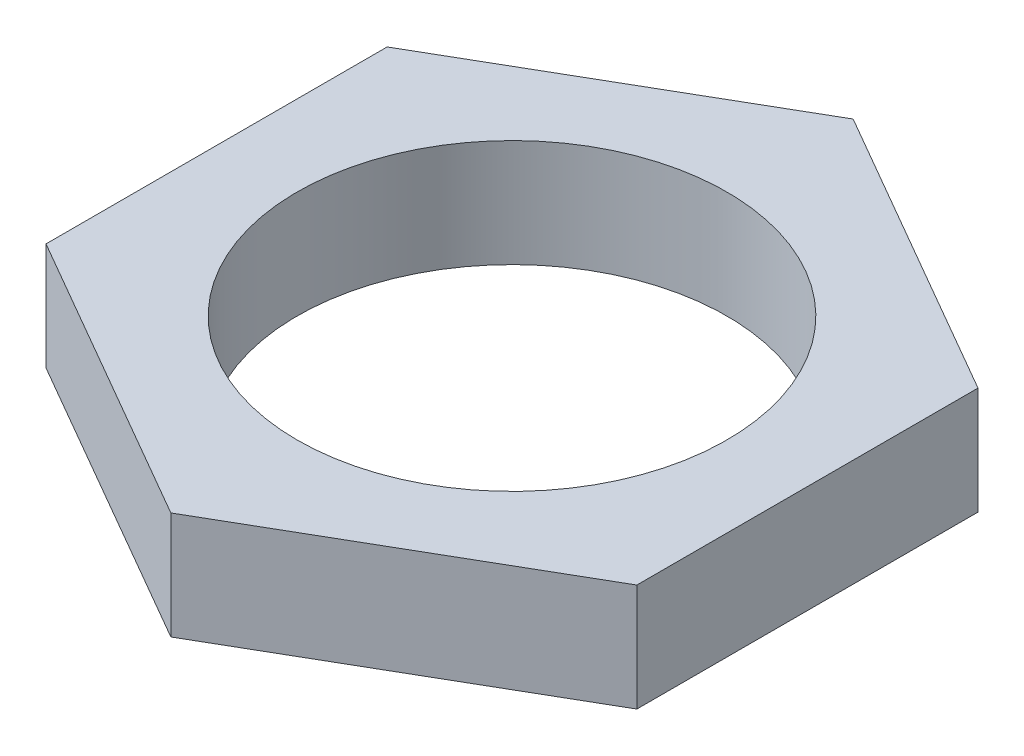
from build123d import *

# Parameters (mm, degrees)
SKETCH_1_R      = 4
EXTRUDE_1_DEPTH = 2


with BuildPart() as part:
    # Эскиз1 → Бобышка-Вытянуть1 (new body)
    with BuildSketch(Plane(origin=(0, 0, 0), x_dir=(1, 0, 0), z_dir=(0, 1, 0))):
        Polygon((0, 6.350852961), (-5.5, 3.175426481), (-5.5, -3.175426481), (0, -6.350852961), (5.5, -3.175426481), (5.5, 3.175426481), align=None)
        with Locations(Location((0, 0, 0), (0, 0, 270))):
            Circle(SKETCH_1_R, mode=Mode.SUBTRACT)
    extrude(amount=EXTRUDE_1_DEPTH)


solid = part.part
